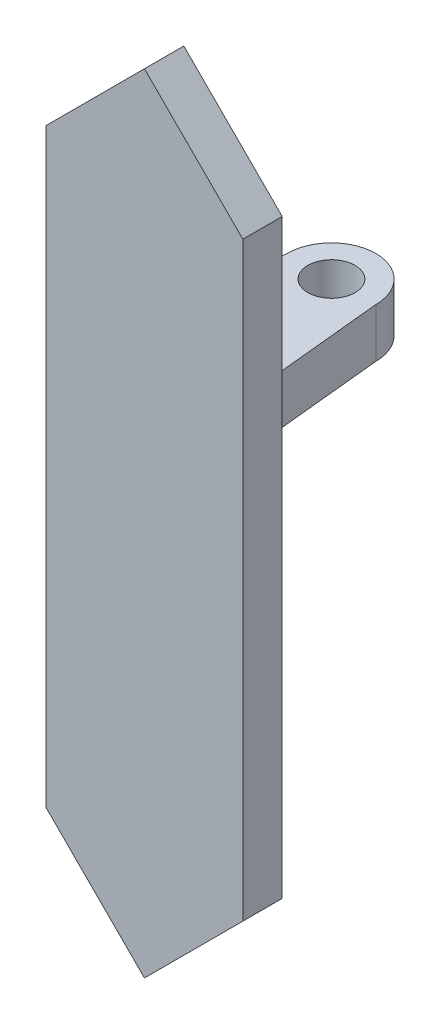
from build123d import *

# Parameters (mm, degrees)
EXTRUDE_1_DEPTH     = 4
SKETCH_2_W          = 12
SKETCH_2_H          = 5
EXTRUDE_2_DEPTH     = 20
SKETCH_6_R          = 2.4
CUT_EXTRUDE_5_DEPTH = 21


with BuildPart() as part:
    # 草图1 → 凸台-拉伸1 (new body)
    with BuildSketch(Plane.XY):
        Polygon((0.147281285, 10), (0.147281285, 70), (10.147281285, 80), (20.147281285, 70), (20.147281285, 10), (10.147281285, 0), align=None)
    extrude(amount=EXTRUDE_1_DEPTH)

    # 草图2 → 凸台-拉伸2 (add)
    with BuildSketch(Plane(origin=(0, 0, 0), x_dir=(-1, 0, 0), z_dir=(0, 0, -1))):
        with Locations((-10.147281285, 49.5)):
            Rectangle(SKETCH_2_W, SKETCH_2_H)
    extrude(amount=EXTRUDE_2_DEPTH)

    # 草图6 → 切除-拉伸5 (cut)
    with BuildSketch(Plane.XZ.offset(-47)):
        with Locations(Location((10.147281285, -15, 0), (0, 0, 270))):
            Circle(SKETCH_6_R)
        with BuildLine():
            ThreePointArc((14.647281285, -15), (10.147281285, -19.5), (5.647281285, -15))
            Line((5.647281285, -15), (4.147281285, 0))
            Line((4.147281285, 0), (4.147281285, -20))
            Line((4.147281285, -20), (16.147281285, -20))
            Line((16.147281285, -20), (16.147281285, 0))
            Line((16.147281285, 0), (14.647281285, -15))
        make_face()
    extrude(amount=-CUT_EXTRUDE_5_DEPTH, mode=Mode.SUBTRACT)


solid = part.part
